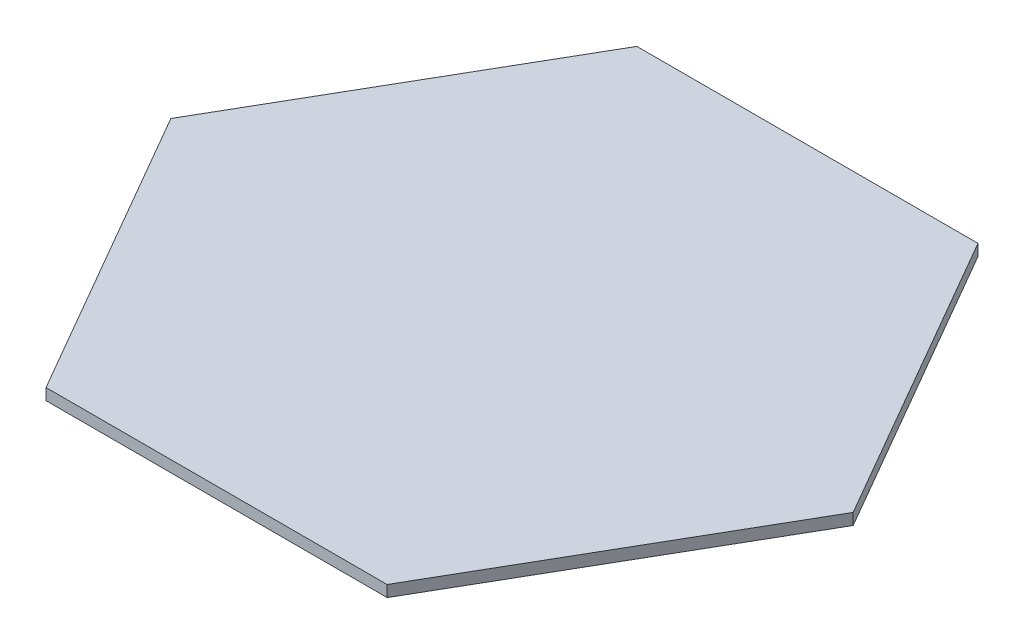
from build123d import *

# Parameters (mm, degrees)
EXTRUDE_1_DEPTH = 2.5


with BuildPart() as part:
    # 草图1 → 凸台-拉伸1 (new body)
    with BuildSketch(Plane(origin=(0, 0, 0), x_dir=(1, 0, 0), z_dir=(0, 1, 0))):
        Polygon((75, 0), (37.5, 64.951905284), (-37.5, 64.951905284), (-75, 0), (-37.5, -64.951905284), (37.5, -64.951905284), align=None)
    extrude(amount=EXTRUDE_1_DEPTH)


solid = part.part
